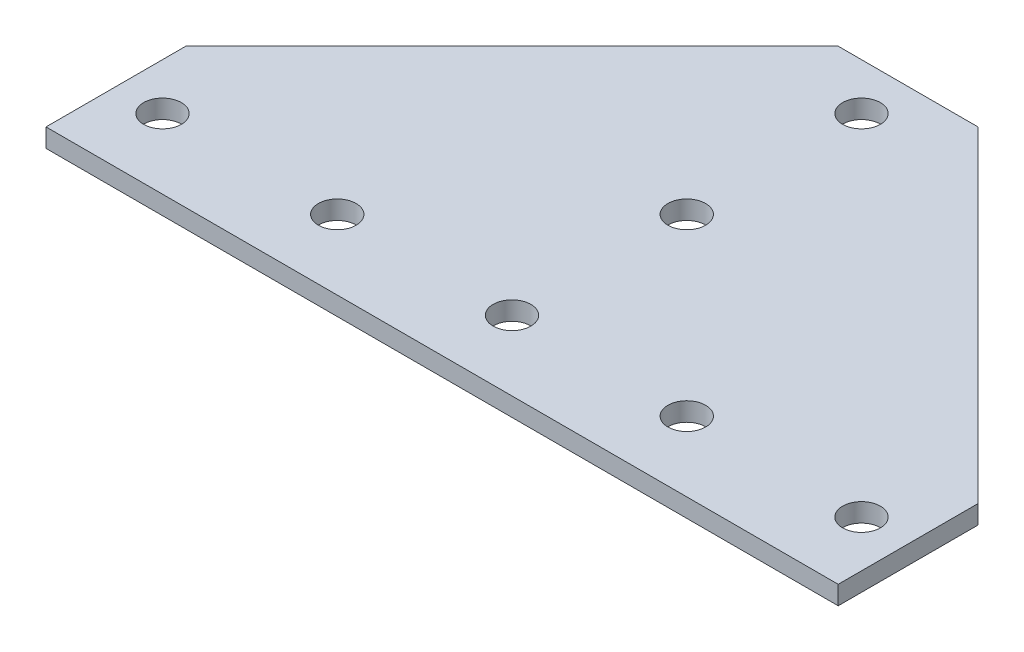
from build123d import *

# Parameters (mm, degrees)
SKETCH1_R           = 4.05
BOSS_EXTRUDE1_DEPTH = 4


with BuildPart() as part:
    # Sketch1 → Boss-Extrude1 (new body)
    with BuildSketch(Plane(origin=(0, 0, 0), x_dir=(1, 0, 0), z_dir=(0, 1, 0))):
        Polygon((85, -15), (-85, -15), (-85, 15), (-15, 85), (15, 85), (85, 15), align=None)
        with Locations(Location((-75, 0, 0), (0, 0, 270))):
            Circle(SKETCH1_R, mode=Mode.SUBTRACT)
        with Locations(Location((-37.5, 0, 0), (0, 0, 270))):
            Circle(SKETCH1_R, mode=Mode.SUBTRACT)
        with Locations(Location((0, 0, 0), (0, 0, 270))):
            Circle(SKETCH1_R, mode=Mode.SUBTRACT)
        with Locations(Location((0, 75, 0), (0, 0, 270))):
            Circle(SKETCH1_R, mode=Mode.SUBTRACT)
        with Locations(Location((0, 37.5, 0), (0, 0, 270))):
            Circle(SKETCH1_R, mode=Mode.SUBTRACT)
        with Locations(Location((75, 0, 0), (0, 0, 270))):
            Circle(SKETCH1_R, mode=Mode.SUBTRACT)
        with Locations(Location((37.5, 0, 0), (0, 0, 270))):
            Circle(SKETCH1_R, mode=Mode.SUBTRACT)
    extrude(amount=BOSS_EXTRUDE1_DEPTH)


solid = part.part
